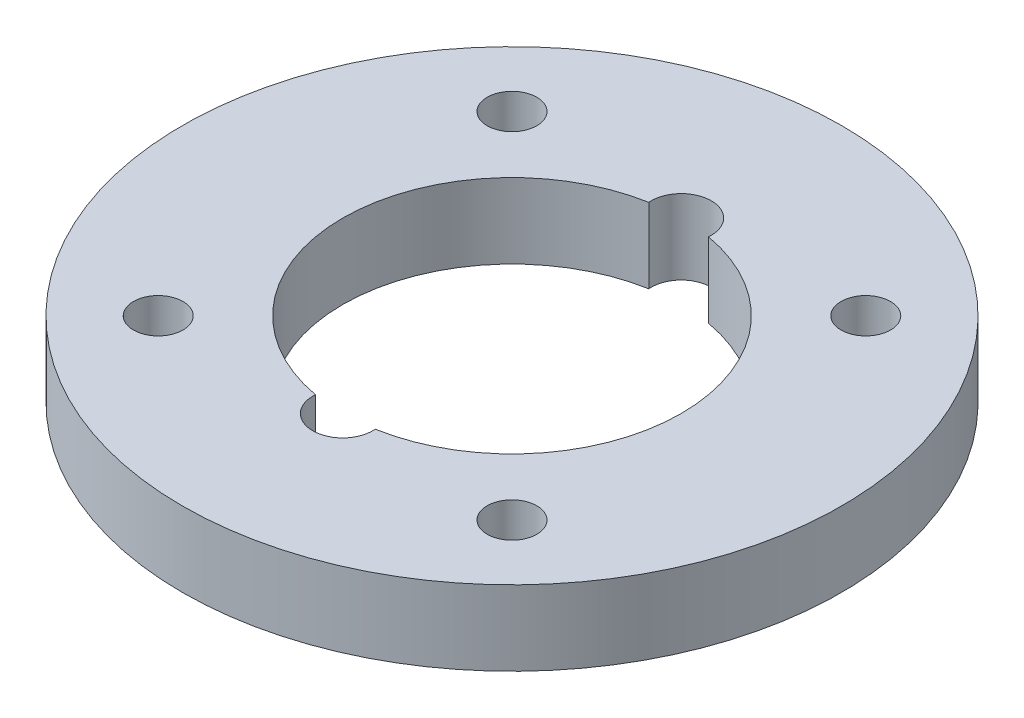
from build123d import *

# Parameters (mm, degrees)
F_0_5IN_SOCKET_R    = 27.94
F_0_5IN_SOCKET_R_2  = 2.1
BOSS_EXTRUDE1_DEPTH = 6.35


with BuildPart() as part:
    # 0.5in Socket → Boss-Extrude1 (new body)
    with BuildSketch(Plane(origin=(0, 0, 0), x_dir=(1, 0, 0), z_dir=(0, 1, 0))):
        with Locations(Location((0, 0, 0), (0, 0, 270))):
            Circle(F_0_5IN_SOCKET_R)
        with Locations(Location((-14.997027722, -14.997027722, 0), (0, 0, 270))):
            Circle(F_0_5IN_SOCKET_R_2, mode=Mode.SUBTRACT)
        with Locations(Location((-14.997027722, 14.997027722, 0), (0, 0, 270))):
            Circle(F_0_5IN_SOCKET_R_2, mode=Mode.SUBTRACT)
        with Locations(Location((14.997027722, 14.997027722, 0), (0, 0, 270))):
            Circle(F_0_5IN_SOCKET_R_2, mode=Mode.SUBTRACT)
        with Locations(Location((14.997027722, -14.997027722, 0), (0, 0, 270))):
            Circle(F_0_5IN_SOCKET_R_2, mode=Mode.SUBTRACT)
        with BuildLine():
            ThreePointArc((2.530034488, -14.126221239), (0, -16.891), (-2.530034488, -14.126221239))
            ThreePointArc((-2.530034488, -14.126221239), (-14.351, 0), (-2.530034488, 14.126221239))
            ThreePointArc((-2.530034488, 14.126221239), (0, 16.891), (2.530034488, 14.126221239))
            ThreePointArc((2.530034488, 14.126221239), (14.351, 0), (2.530034488, -14.126221239))
        make_face(mode=Mode.SUBTRACT)
    extrude(amount=BOSS_EXTRUDE1_DEPTH)


solid = part.part
